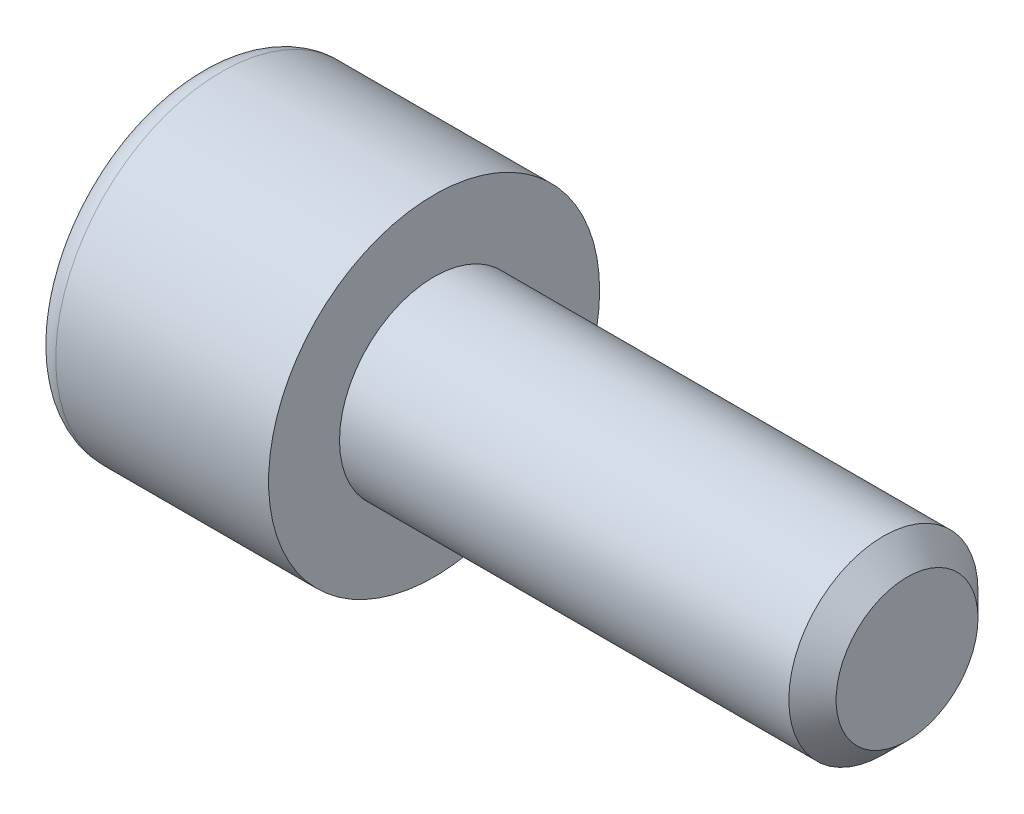
from build123d import *

# Parameters (mm, degrees)
SKETCH_1_R          = 3.5
EXTRUDE_1_DEPTH     = 5
SKETCH_2_R          = 2
EXTRUDE_2_DEPTH     = 10
CHAMFER_1_SIZE      = 0.5
CUT_EXTRUDE_1_DEPTH = 4
FILLET_1_R          = 1
FILLET_2_R          = 0.5


with BuildPart() as part:
    # Эскиз1 → Вытянуть1 (new body)
    with BuildSketch(Plane(origin=(0, 0, 0), x_dir=(0, 0, -1), z_dir=(1, 0, 0))):
        Circle(SKETCH_1_R)
    extrude(amount=EXTRUDE_1_DEPTH)

    # Эскиз2 → Вытянуть2 (add)
    with BuildSketch(Plane(origin=(5, 0, 0), x_dir=(0, 0, -1), z_dir=(1, 0, 0))):
        Circle(SKETCH_2_R)
    extrude(amount=EXTRUDE_2_DEPTH)

    # Фаска1
    chamfer_1_edges = [part.edges().sort_by_distance(p)[0] for p in [
        (15, 0, 2),
    ]]
    chamfer(chamfer_1_edges, length=CHAMFER_1_SIZE)

    # Эскиз3 → Вырез-Вытянуть1 (cut)
    with BuildSketch(Plane.ZY):
        Polygon((0, 1.732050808), (-1.5, 0.866025404), (-1.5, -0.866025404), (0, -1.732050808), (1.5, -0.866025404), (1.5, 0.866025404), align=None)
    extrude(amount=-CUT_EXTRUDE_1_DEPTH, mode=Mode.SUBTRACT)

    # Скругление1
    fillet_1_edges = [part.edges().sort_by_distance(p)[0] for p in [
        (4, 1.299038106, 0.75),
        (4, 0, 1.5),
        (4, -1.299038106, 0.75),
        (4, -1.299038106, -0.75),
        (4, 0, -1.5),
        (4, 1.299038106, -0.75),
    ]]
    fillet(fillet_1_edges, radius=FILLET_1_R)

    # Скругление2
    fillet_2_edges = [part.edges().sort_by_distance(p)[0] for p in [
        (0, 0, 3.5),
    ]]
    fillet(fillet_2_edges, radius=FILLET_2_R)


solid = part.part
